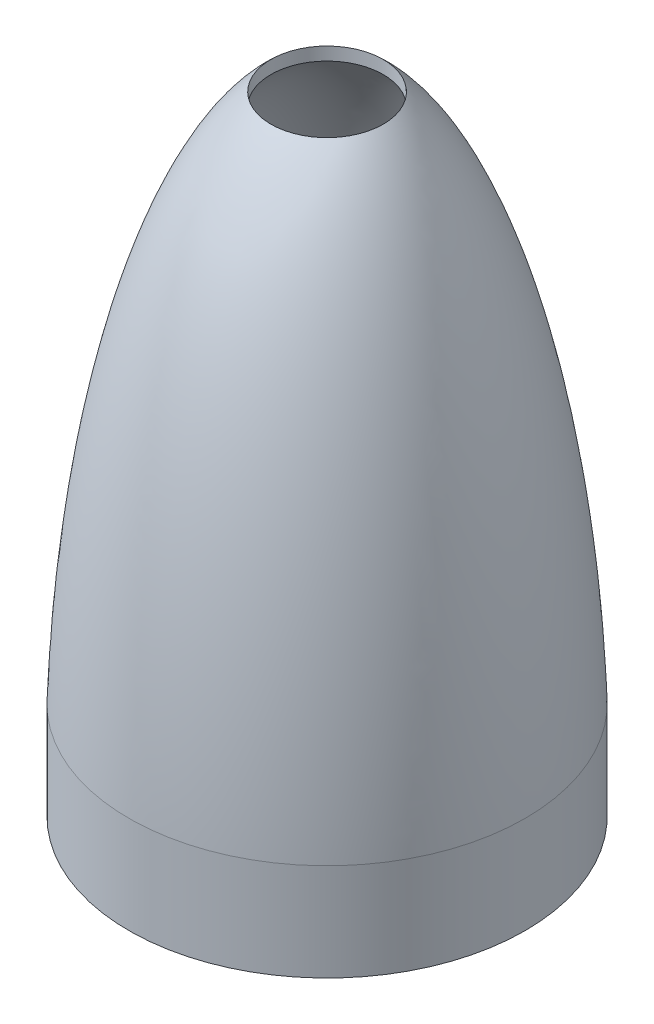
from build123d import *

# Parameters (mm, degrees)
CUT_EXTRUDE2_REACH = 219.337
SKETCH3_R          = 1.125
FILLET1_R          = 2
CUT_EXTRUDE3_REACH = 229.395
SKETCH4_R          = 18


with BuildPart() as part:
    # Sketch1 → Revolve1 (revolve)
    with BuildSketch(Plane.XY):
        with BuildLine():
            Line((0, 197.916397287), (0, 194.918))
            add(Edge.make_bspline(
                [(60.5, 19.918), (60.499732959, 19.926145969), (60.402409896, 22.893098065), (60.16281033, 28.850509892), (59.508128944, 40.695567648), (58.357918827, 55.359639545), (56.463723352, 72.478995962), (53.275435607, 94.479197256), (48.098712363, 120.069808877), (40.204540851, 146.657332098), (30.934325295, 168.183935188), (22.399641779, 181.237585072), (15.390298271, 188.463802804), (10.146054193, 192.252428145), (5.868237085, 194.081198554), (2.503488005, 194.799314319), (0.838027003, 194.918), (0, 194.918)],
                knots=[-1.469488295, -1.469488295, -1.469488295, -1.469488295, -1.469363565, -1.424050115, -1.378113015, -1.286238814, -1.194364613, -1.102490412, -0.91874201, -0.734993608, -0.551245206, -0.367496804, -0.275622603, -0.183748402, -0.091874201, -0.0459371, 0, 0, 0, 0], degree=3))
            Line((60.5, 19.918), (60.5, -11.258))
            Line((60.5, -11.258), (63.5, -11.258))
            Line((63.5, -11.258), (63.5, 19.918))
            add(Edge.make_bspline(
                [(63.5, 19.918), (57.693786584, 197.916397287), (0, 197.916397287)],
                knots=[4.813198091, 4.813198091, 4.813198091, 6.283185307, 6.283185307, 6.283185307], degree=2, weights=[1, 0.74183504, 1]))
        make_face()
    revolve(axis=Axis((0, 19.918, 0), (0, 1, 0)))

    # Sketch3 → Cut-Extrude2 (cut, up to next)
    with BuildSketch(Plane(origin=(0, 0, 0), x_dir=(1, 0, 0), z_dir=(0, 1, 0)), mode=Mode.PRIVATE) as cut_extrude2_sk1:
        Circle(SKETCH3_R)
    cut_extrude2_tool1 = extrude(cut_extrude2_sk1.sketch, amount=CUT_EXTRUDE2_REACH, mode=Mode.PRIVATE) & part.part
    add(cut_extrude2_tool1.solids().sort_by_distance((0, 0, 0))[0], mode=Mode.SUBTRACT)

    # Fillet1
    fillet1_edges = [part.edges().sort_by_distance(p)[0] for p in [
        (-1.125, 197.885648917, 0),
    ]]
    fillet(fillet1_edges, radius=FILLET1_R)

    # Sketch4 → Cut-Extrude3 (cut, up to next)
    with BuildSketch(Plane(origin=(0, -11.258, 0), x_dir=(-1, 0, 0), z_dir=(0, -1, 0)), mode=Mode.PRIVATE) as cut_extrude3_sk1:
        with Locations(Location((0, 0, 0), (0, 0, 180))):
            Circle(SKETCH4_R)
    cut_extrude3_tool1 = extrude(cut_extrude3_sk1.sketch, amount=-CUT_EXTRUDE3_REACH, mode=Mode.PRIVATE) & part.part
    add(cut_extrude3_tool1.solids().sort_by_distance((0, -11.258, 0))[0], mode=Mode.SUBTRACT)


solid = part.part
